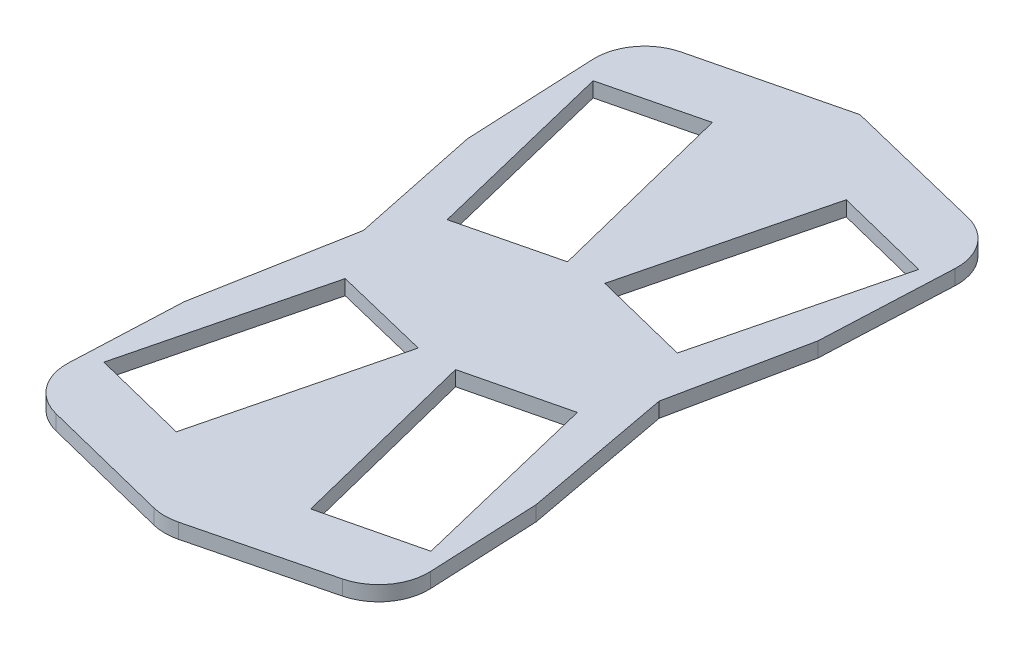
from build123d import *

# Parameters (mm, degrees)
SALIENTE_EXTRUIR1_DEPTH = 3


with BuildPart() as part:
    # Croquis1 → Saliente-Extruir1 (new body)
    with BuildSketch(Plane(origin=(0, 0, 0), x_dir=(1, 0, 0), z_dir=(0, 1, 0))):
        with BuildLine():
            Line((-35.322649353, -4.523785763), (-29.713798408, 25.866039525))
            Line((-29.713798408, 25.866039525), (-35.221795469, 52.273603799))
            Line((-35.221795469, 52.273603799), (-36.45117663, 78.681168073))
            ThreePointArc((-36.45117663, 78.681168073), (-34.470773885, 85.134483293), (-28.840989272, 88.859103754))
            Line((-28.840989272, 88.859103754), (0, 95.923167849))
            Line((0, 95.923167849), (28.745582144, 88.873347738))
            ThreePointArc((28.745582144, 88.873347738), (34.369430491, 85.153487685), (36.353462125, 78.709215227))
            Line((36.353462125, 78.709215227), (35.159044734, 52.307970662))
            Line((35.159044734, 52.307970662), (29.69822954, 25.906726097))
            Line((29.69822954, 25.906726097), (35.352965357, -4.492390106))
            Line((35.352965357, -4.492390106), (36.368027066, -26.718230301))
            ThreePointArc((36.368027066, -26.718230301), (34.398862632, -33.147130574), (28.803795931, -36.875883169))
            Line((28.803795931, -36.875883169), (2.42535625, -43.470493089))
            ThreePointArc((2.42535625, -43.470493089), (0, -43.769068087), (-2.42535625, -43.470493089))
            Line((-2.42535625, -43.470493089), (-28.730703822, -36.894156196))
            ThreePointArc((-28.730703822, -36.894156196), (-34.320110297, -33.172996946), (-36.295781209, -26.755426116))
            Line((-36.295781209, -26.755426116), (-35.322649353, -4.523785763))
        make_face()
        Polygon((-3.75, 40.923167849), (-23.175796102, 36.165180269), (-32.691771262, 75.016772472), (-13.451535653, 79.72931046), align=None, mode=Mode.SUBTRACT)
        Polygon((13.453962591, 79.739018214), (3.75, 40.923167849), (23.155384938, 36.082606371), (32.856809939, 74.888306377), align=None, mode=Mode.SUBTRACT)
        Polygon((-3.75, 10.923167849), (-13.474641094, -27.975396528), (-32.877491097, -23.124684028), (-23.176066096, 15.681015978), align=None, mode=Mode.SUBTRACT)
        Polygon((3.75, 10.923167849), (23.449436749, 15.706069173), (32.88700521, -23.164643472), (13.451648888, -27.883427703), align=None, mode=Mode.SUBTRACT)
    extrude(amount=SALIENTE_EXTRUIR1_DEPTH)


solid = part.part
